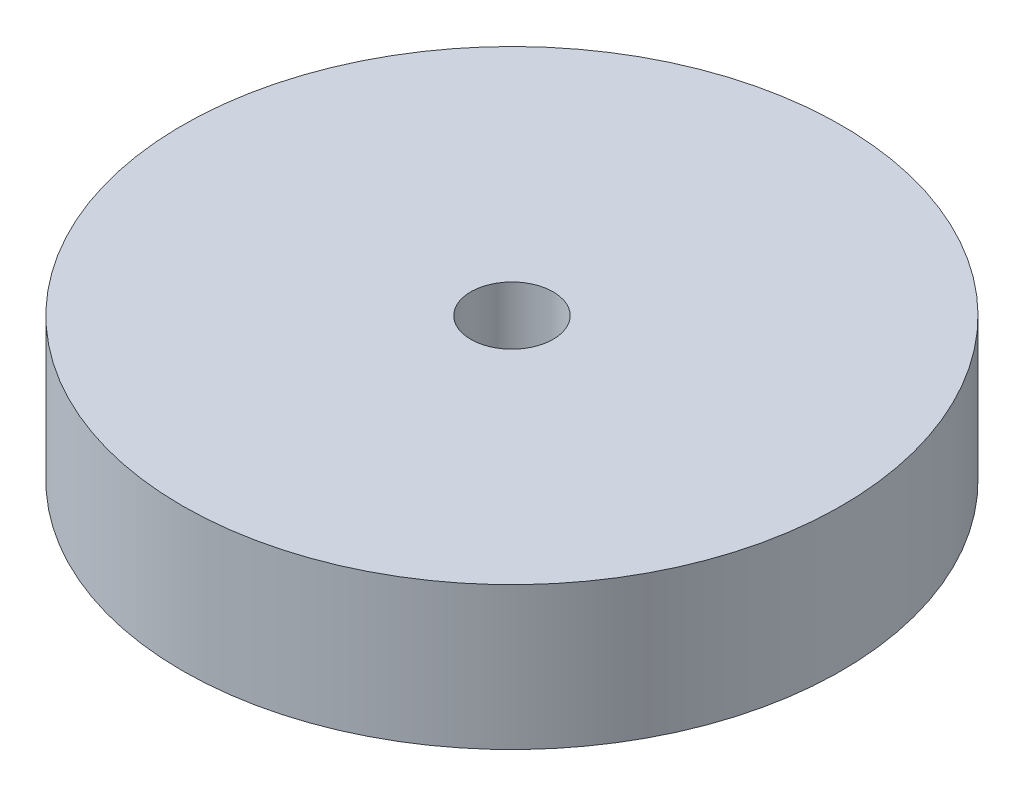
from build123d import *

# Parameters (mm, degrees)
SKETCH1_R           = 300
SKETCH1_R_2         = 37.5
BOSS_EXTRUDE1_DEPTH = 130


with BuildPart() as part:
    # Sketch1 → Boss-Extrude1 (new body)
    with BuildSketch(Plane(origin=(0, 0, 0), x_dir=(1, 0, 0), z_dir=(0, 1, 0))):
        with Locations(Location((0, 0, 0), (0, 0, 270))):
            Circle(SKETCH1_R)
        with Locations(Location((0, 0, 0), (0, 0, 270))):
            Circle(SKETCH1_R_2, mode=Mode.SUBTRACT)
    extrude(amount=BOSS_EXTRUDE1_DEPTH)


solid = part.part
